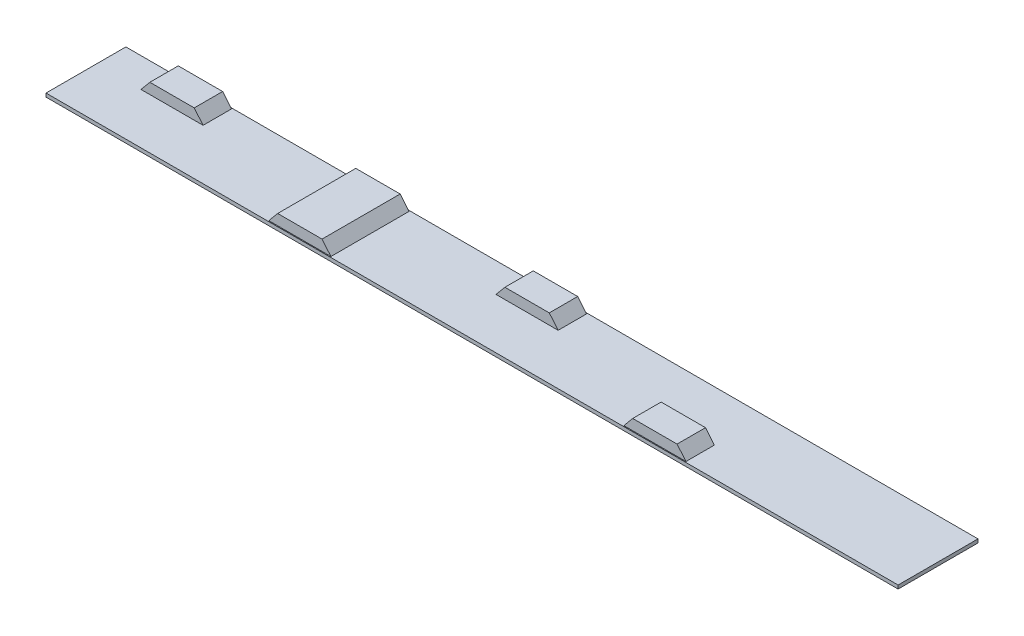
from build123d import *

# Parameters (mm, degrees)
SKETCH1_W                = 2400
SKETCH1_H                = 225
BOSS_EXTRUDE1_DEPTH      = 10
BOSS_EXTRUDE2_START      = 30
BOSS_EXTRUDE2_DEPTH      = 80
BOSS_EXTRUDE3_START      = -30
BOSS_EXTRUDE3_DEPTH      = 80
BOSS_EXTRUDE4_DEPTH      = 110
BOSS_EXTRUDE4_DEPTH_BACK = 110
BOSS_EXTRUDE5_START      = -30
BOSS_EXTRUDE5_DEPTH      = 80


with BuildPart() as part:
    # Sketch1 → Boss-Extrude1 (new body)
    with BuildSketch(Plane(origin=(0, 0, 0), x_dir=(1, 0, 0), z_dir=(0, 1, 0))):
        Rectangle(SKETCH1_W, SKETCH1_H)
    extrude(amount=BOSS_EXTRUDE1_DEPTH)

    # Sketch2 → Boss-Extrude2 (add)
    with BuildSketch(Plane.XY.offset(BOSS_EXTRUDE2_START)):
        Polygon((425, 10), (450, 40), (575, 40), (600, 10), align=None)
    extrude(amount=BOSS_EXTRUDE2_DEPTH)

    # Sketch3 → Boss-Extrude3 (add)
    with BuildSketch(Plane.XY.offset(BOSS_EXTRUDE3_START)):
        Polygon((-50, 40), (-75, 10), (100, 10), (75, 40), align=None)
    extrude(amount=-BOSS_EXTRUDE3_DEPTH)

    # Sketch4 → Boss-Extrude4 (add, two sides: drawn at the far end of the back side and taken through both)
    with BuildSketch(Plane.XY.offset(-BOSS_EXTRUDE4_DEPTH_BACK)):
        Polygon((-550, 40), (-575, 10), (-400, 10), (-425, 40), align=None)
    extrude(amount=BOSS_EXTRUDE4_DEPTH + BOSS_EXTRUDE4_DEPTH_BACK)

    # Sketch5 → Boss-Extrude5 (add)
    with BuildSketch(Plane.XY.offset(BOSS_EXTRUDE5_START)):
        Polygon((-1050, 40), (-1075, 10), (-900, 10), (-925, 40), align=None)
    extrude(amount=-BOSS_EXTRUDE5_DEPTH)


solid = part.part
